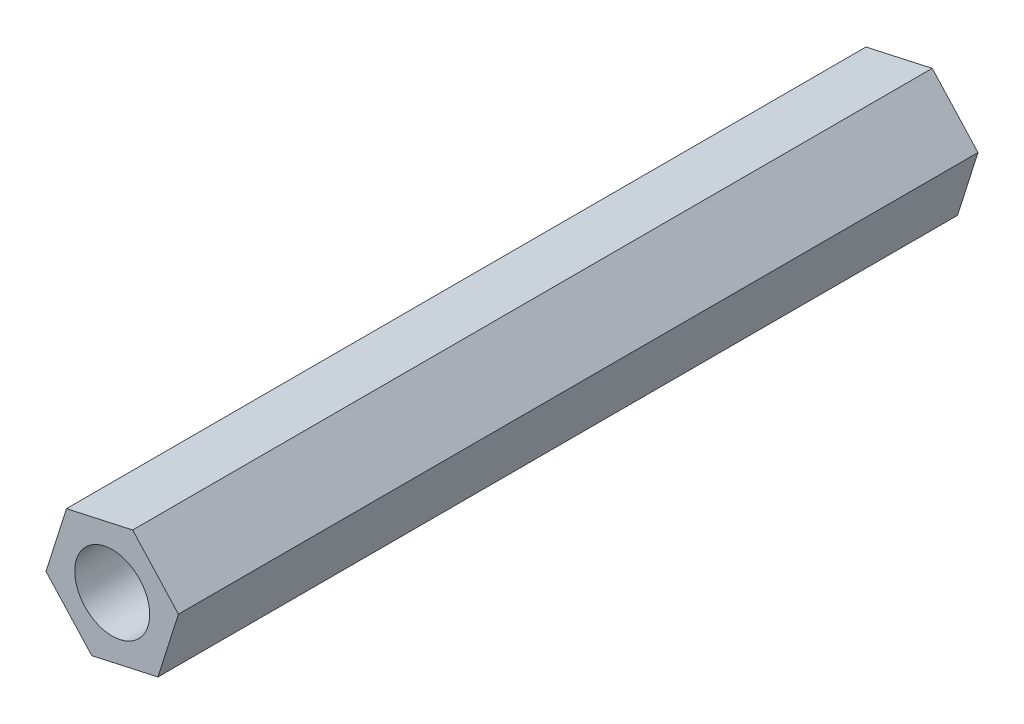
from build123d import *

# Parameters (mm, degrees)
SKETCH_1_R      = 1.5
EXTRUDE_1_DEPTH = 32


with BuildPart() as part:
    # 草图1 → 凸台-拉伸1 (new body)
    with BuildSketch(Plane.XY):
        Polygon((2.649803949, 0.584698524), (0.818538199, 2.587146797), (-1.83126575, 2.002448273), (-2.649803949, -0.584698524), (-0.818538199, -2.587146797), (1.83126575, -2.002448273), align=None)
        Circle(SKETCH_1_R, mode=Mode.SUBTRACT)
    extrude(amount=EXTRUDE_1_DEPTH)


solid = part.part
